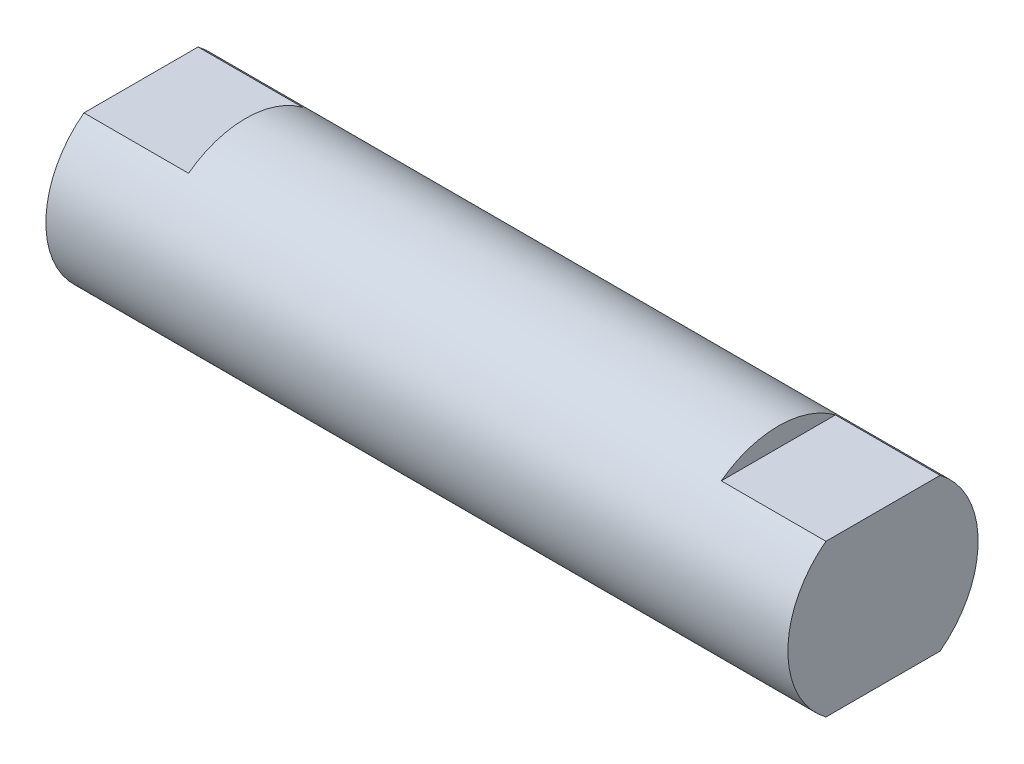
from build123d import *

# Parameters (mm, degrees)
SKETCH1_R           = 2.5
BOSS_EXTRUDE1_DEPTH = 9.75
CUT_EXTRUDE1_START  = -2.749999999
CUT_EXTRUDE1_DEPTH  = 2.749999999


with BuildPart() as part:
    # Sketch1 → Boss-Extrude1 (new, symmetric)
    with BuildSketch(Plane(origin=(0, 0, 0), x_dir=(0, 0, -1), z_dir=(1, 0, 0))):
        with Locations(Location((0, 0, 0), (0, 0, 180))):
            Circle(SKETCH1_R)
    extrude(amount=BOSS_EXTRUDE1_DEPTH, both=True)

    # Sketch2 → Cut-Extrude1 (cut)
    with BuildSketch(Plane.ZY.offset(9.75).offset(CUT_EXTRUDE1_START)):
        with BuildLine():
            Line((-1.5, 2), (1.5, 2))
            ThreePointArc((1.5, 2), (0, 2.5), (-1.5, 2))
        make_face()
        with BuildLine():
            Line((1.5, -2), (-1.5, -2))
            ThreePointArc((-1.5, -2), (0, -2.5), (1.5, -2))
        make_face()
    cut_extrude1 = extrude(amount=CUT_EXTRUDE1_DEPTH, mode=Mode.SUBTRACT)

    # Mirror1: Cut-Extrude1 across plane
    add(cut_extrude1.mirror(Plane(origin=(0, 0, 0), x_dir=(0, 0, 1), z_dir=(1, 0, 0))), mode=Mode.SUBTRACT)


solid = part.part
